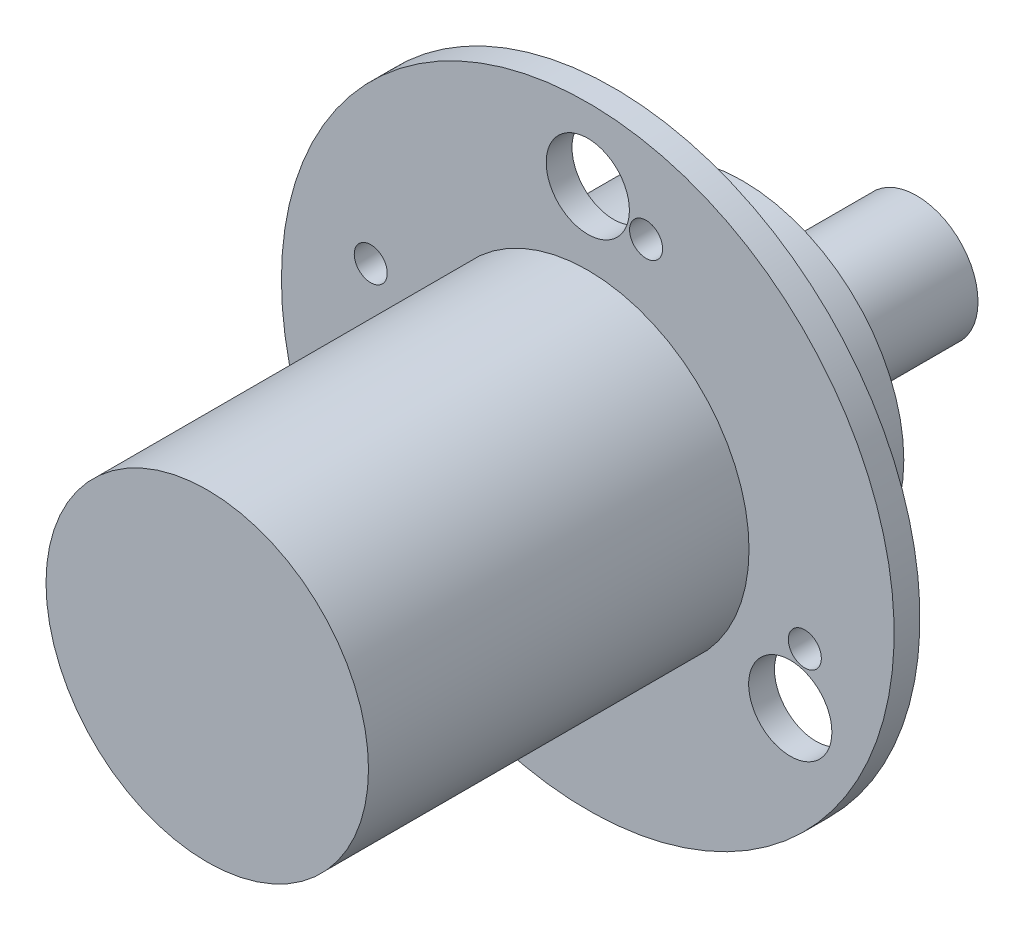
from build123d import *

# Parameters (mm, degrees)
SKETCH1_R          = 6.35
EXTRUDE1_DEPTH     = 21.082
SKETCH2_R          = 2.413
EXTRUDE2_DEPTH     = 6.858
SKETCH3_R          = 12.065
EXTRUDE3_DEPTH     = 1.016
SKETCH4_R          = 1.6383
CUT_EXTRUDE1_DEPTH = 23.709219405
SKETCH6_R          = 0.65
CUT_EXTRUDE2_DEPTH = 24.392145135


with BuildPart() as part:
    # Sketch1 → Extrude1 (new body)
    with BuildSketch(Plane.XY):
        Circle(SKETCH1_R)
    extrude(amount=EXTRUDE1_DEPTH)

    # Sketch2 → Extrude2 (add)
    with BuildSketch(Plane(origin=(0, 0, 0), x_dir=(-1, 0, 0), z_dir=(0, 0, -1))):
        with Locations(Location((0, 0, 0), (0, 0, 180))):
            Circle(SKETCH2_R)
    extrude(amount=EXTRUDE2_DEPTH)

    # Sketch3 → Extrude3 (add)
    with BuildSketch(Plane(origin=(0, 0, 5.08), x_dir=(-1, 0, 0), z_dir=(0, 0, -1))):
        Circle(SKETCH3_R)
    extrude(amount=-EXTRUDE3_DEPTH)

    # Sketch4 → Cut-Extrude1 (cut, through all)
    with BuildSketch(Plane.XY.offset(6.096)):
        with Locations((0, 9.2075)):
            Circle(SKETCH4_R)
        with Locations((7.973928905, -4.60375)):
            Circle(SKETCH4_R)
        with Locations((-7.973928905, -4.60375)):
            Circle(SKETCH4_R)
    extrude(amount=-CUT_EXTRUDE1_DEPTH, mode=Mode.SUBTRACT)

    # Sketch6 → Cut-Extrude2 (cut, through all)
    with BuildSketch(Plane(origin=(0, 0, 5.08), x_dir=(-1, 0, 0), z_dir=(0, 0, -1))):
        with Locations((-8.547087459, -2.295603618)):
            Circle(SKETCH6_R)
        with Locations((-2.295603618, 8.547087459)):
            Circle(SKETCH6_R)
        with Locations((8.547087459, 2.295603618)):
            Circle(SKETCH6_R)
    extrude(amount=-CUT_EXTRUDE2_DEPTH, mode=Mode.SUBTRACT)


solid = part.part
